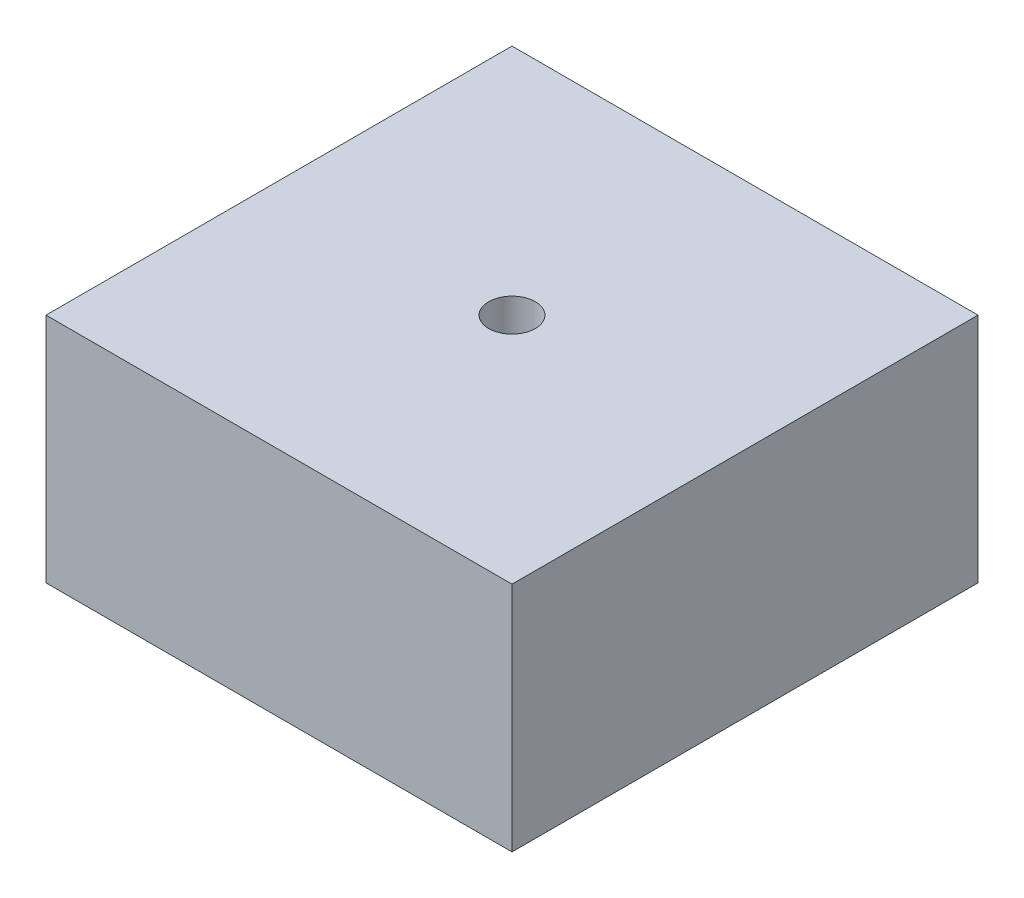
from build123d import *

# Parameters (mm, degrees)
SKETCH1_W           = 100
SKETCH1_H           = 100
BOSS_EXTRUDE1_DEPTH = 49.7625
SKETCH2_R           = 5
CUT_EXTRUDE1_DEPTH  = 87.465637141


with BuildPart() as part:
    # Sketch1 → Boss-Extrude1 (new body)
    with BuildSketch(Plane(origin=(0, -12.5, 0), x_dir=(1, 0, 0), z_dir=(0, 1, 0))):
        Rectangle(SKETCH1_W, SKETCH1_H)
    extrude(amount=BOSS_EXTRUDE1_DEPTH)

    # Sketch2 → Cut-Extrude1 (cut, through all)
    with BuildSketch(Plane(origin=(0, 37.2625, 0), x_dir=(-1, 0, 0), z_dir=(0, 1, 0))):
        with Locations(Location((0, 0, 0), (0, 0, 90))):
            Circle(SKETCH2_R)
    extrude(amount=-CUT_EXTRUDE1_DEPTH, mode=Mode.SUBTRACT)


solid = part.part
